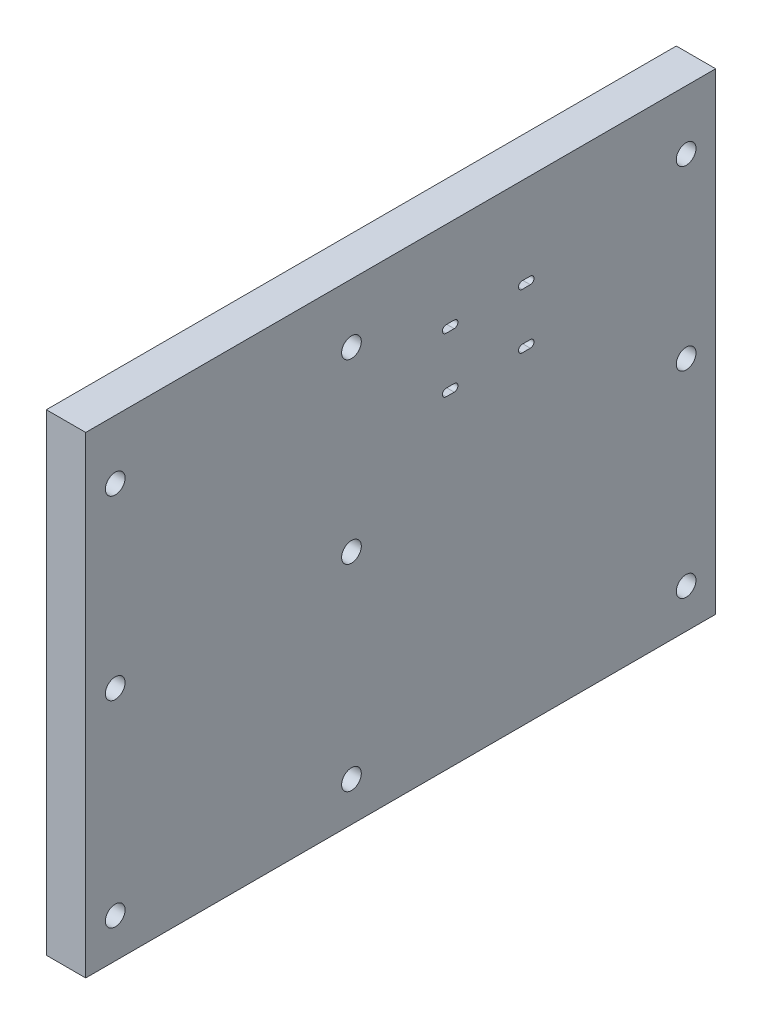
from build123d import *

# Parameters (mm, degrees)
SKETCH1_W           = 203.2
SKETCH1_H           = 152.4
SKETCH1_R           = 3.175
BOSS_EXTRUDE1_DEPTH = 12.7


with BuildPart() as part:
    # Sketch1 → Boss-Extrude1 (new body)
    with BuildSketch(Plane(origin=(0, 0, 0), x_dir=(0, 0, -1), z_dir=(1, 0, 0))):
        Rectangle(SKETCH1_W, SKETCH1_H)
        with Locations((-15.875, 57.15)):
            Circle(SKETCH1_R, mode=Mode.SUBTRACT)
        with Locations((-15.875, 0)):
            Circle(SKETCH1_R, mode=Mode.SUBTRACT)
        with Locations((-92.075, 0)):
            Circle(SKETCH1_R, mode=Mode.SUBTRACT)
        with Locations((-92.075, 57.15)):
            Circle(SKETCH1_R, mode=Mode.SUBTRACT)
        with Locations((92.075, 57.15)):
            Circle(SKETCH1_R, mode=Mode.SUBTRACT)
        with Locations((92.075, 0)):
            Circle(SKETCH1_R, mode=Mode.SUBTRACT)
        with Locations((-15.875, -63.5)):
            Circle(SKETCH1_R, mode=Mode.SUBTRACT)
        with Locations((-92.075, -63.5)):
            Circle(SKETCH1_R, mode=Mode.SUBTRACT)
        with Locations((92.075, -63.5)):
            Circle(SKETCH1_R, mode=Mode.SUBTRACT)
        with BuildLine():
            ThreePointArc((17.261210647, 30.43), (18.461210647, 29.23), (17.261210647, 28.03))
            Line((17.261210647, 28.03), (14.661210647, 28.03))
            ThreePointArc((14.661210647, 28.03), (13.461210647, 29.23), (14.661210647, 30.43))
            Line((14.661210647, 30.43), (17.261210647, 30.43))
        make_face(mode=Mode.SUBTRACT)
        with BuildLine():
            Line((41.801210647, 28.03), (39.201210647, 28.03))
            ThreePointArc((39.201210647, 28.03), (38.001210647, 29.23), (39.201210647, 30.43))
            Line((39.201210647, 30.43), (41.801210647, 30.43))
            ThreePointArc((41.801210647, 30.43), (43.001210647, 29.23), (41.801210647, 28.03))
        make_face(mode=Mode.SUBTRACT)
        with BuildLine():
            ThreePointArc((39.201210647, 45.77), (38.001210647, 46.97), (39.201210647, 48.17))
            Line((39.201210647, 48.17), (41.801210647, 48.17))
            ThreePointArc((41.801210647, 48.17), (43.001210647, 46.97), (41.801210647, 45.77))
            Line((41.801210647, 45.77), (39.201210647, 45.77))
        make_face(mode=Mode.SUBTRACT)
        with BuildLine():
            Line((14.661210647, 48.17), (17.261210647, 48.17))
            ThreePointArc((17.261210647, 48.17), (18.461210647, 46.97), (17.261210647, 45.77))
            Line((17.261210647, 45.77), (14.661210647, 45.77))
            ThreePointArc((14.661210647, 45.77), (13.461210647, 46.97), (14.661210647, 48.17))
        make_face(mode=Mode.SUBTRACT)
    extrude(amount=BOSS_EXTRUDE1_DEPTH)


solid = part.part
